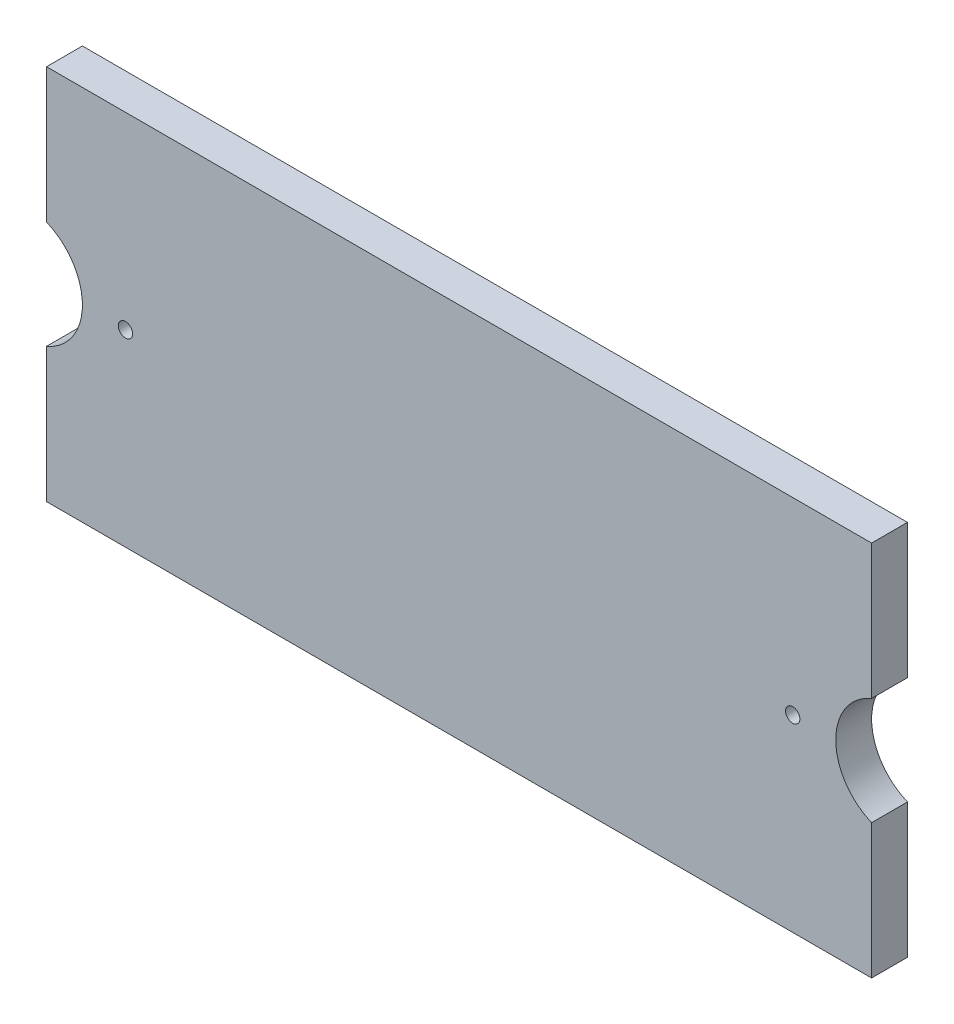
from build123d import *

# Parameters (mm, degrees)
SKETCH1_R           = 2
BOSS_EXTRUDE1_DEPTH = 10


with BuildPart() as part:
    # Sketch1 → Boss-Extrude1 (new body)
    with BuildSketch(Plane.XY):
        with BuildLine():
            Line((0, 0), (230, 0))
            Line((230, 0), (230, 37.5))
            ThreePointArc((230, 37.5), (220, 52.5), (230, 67.5))
            Line((230, 67.5), (230, 105))
            Line((230, 105), (0, 105))
            Line((0, 105), (0, 67.5))
            ThreePointArc((0, 67.5), (10, 52.5), (0, 37.5))
            Line((0, 37.5), (0, 0))
        make_face()
        with Locations((208, 52.5)):
            Circle(SKETCH1_R, mode=Mode.SUBTRACT)
        with Locations(Location((22, 52.5, 0), (0, 0, 180))):
            Circle(SKETCH1_R, mode=Mode.SUBTRACT)
    extrude(amount=BOSS_EXTRUDE1_DEPTH)


solid = part.part
